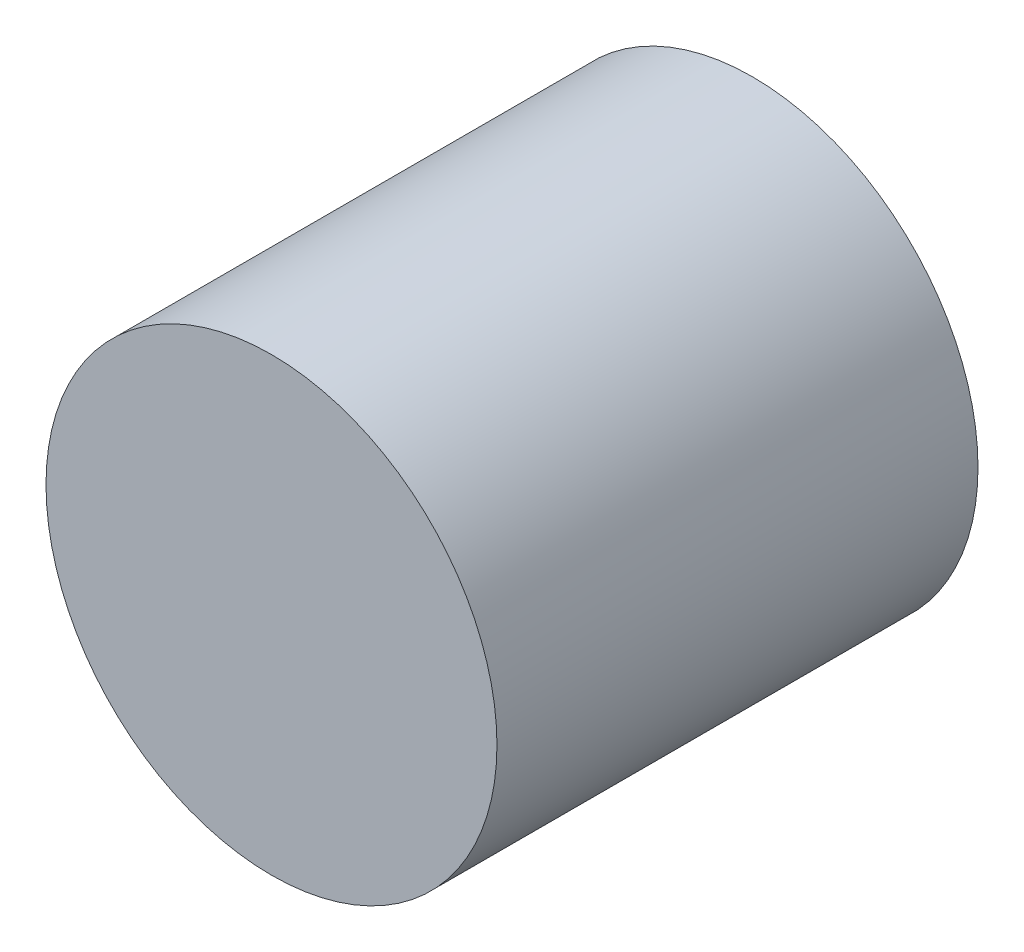
from build123d import *

# Parameters (mm, degrees)
SKETCH_1_R      = 7.5
EXTRUDE_1_DEPTH = 16


with BuildPart() as part:
    # 草图1 → 凸台-拉伸1 (new body)
    with BuildSketch(Plane.XY):
        with Locations((-25.656331714, 30)):
            Circle(SKETCH_1_R)
    extrude(amount=EXTRUDE_1_DEPTH)


solid = part.part
